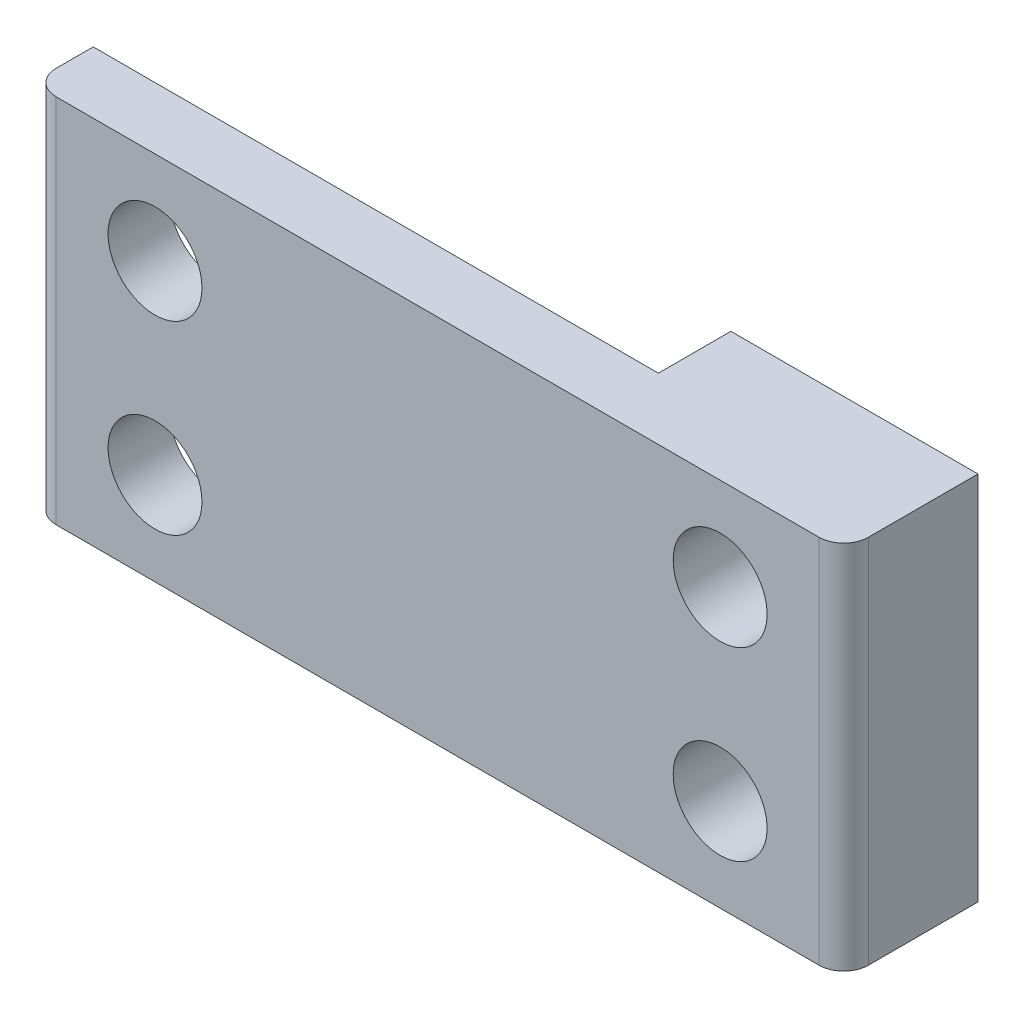
from build123d import *

# Parameters (mm, degrees)
SKETCH1_W               = 83.4898
SKETCH1_H               = 38.1
BOSS_EXTRUDE1_DEPTH     = 6.35
SKETCH2_W               = 25.4
SKETCH2_H               = 38.1
BOSS_EXTRUDE2_DEPTH     = 7.4549
CUT_EXTRUDE1_DEPTH      = 48.917788347
CUT_EXTRUDE1_DEPTH_BACK = 48.917788347
SKETCH6_R               = 4.826
SKETCH8_R               = 4.826
CUT_EXTRUDE2_DEPTH      = 48.917788347
FILLET1_R               = 2.54


with BuildPart() as part:
    # Sketch1 → Boss-Extrude1 (new body)
    with BuildSketch(Plane.XY):
        Rectangle(SKETCH1_W, SKETCH1_H)
    extrude(amount=BOSS_EXTRUDE1_DEPTH)

    # Sketch2 → Boss-Extrude2 (add)
    with BuildSketch(Plane(origin=(0, 0, 0), x_dir=(-1, 0, 0), z_dir=(0, 0, -1))):
        with Locations((-29.0449, 0)):
            Rectangle(SKETCH2_W, SKETCH2_H)
    extrude(amount=BOSS_EXTRUDE2_DEPTH)

    # Sketch6 → Cut-Extrude1 (cut, two sides: drawn at the far end of the back side and taken through both)
    with BuildSketch(Plane(origin=(0, 0, -7.4549), x_dir=(-1, 0, 0), z_dir=(0, 0, -1)).offset(-CUT_EXTRUDE1_DEPTH_BACK)):
        with Locations((-29.0449, 9.525)):
            Circle(SKETCH6_R)
        with Locations((-29.0449, -9.525)):
            Circle(SKETCH6_R)
    extrude(amount=CUT_EXTRUDE1_DEPTH + CUT_EXTRUDE1_DEPTH_BACK, mode=Mode.SUBTRACT)

    # Sketch8 → Cut-Extrude2 (cut, through all)
    with BuildSketch(Plane.XY.offset(6.35)):
        with Locations((-29.0449, -9.525)):
            Circle(SKETCH8_R)
        with Locations((-29.0449, 9.525)):
            Circle(SKETCH8_R)
    extrude(amount=-CUT_EXTRUDE2_DEPTH, mode=Mode.SUBTRACT)

    # Fillet1
    fillet1_edges = [part.edges().sort_by_distance(p)[0] for p in [
        (-41.7449, 0, 6.35),
        (41.7449, 0, 6.35),
    ]]
    fillet(fillet1_edges, radius=FILLET1_R)


solid = part.part
